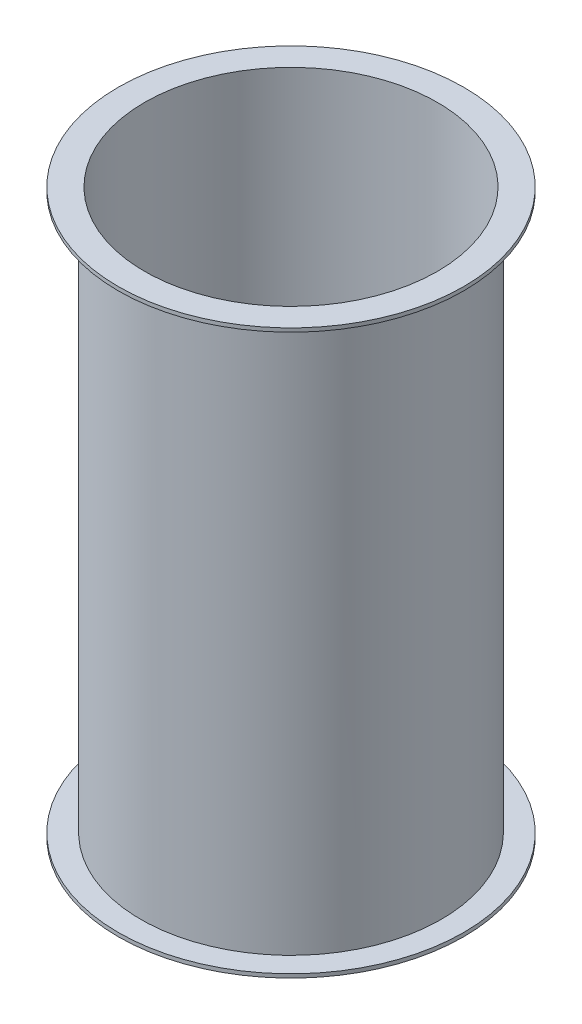
from build123d import *

# Parameters (mm, degrees)
SCHIZZO1_R                   = 40
SCHIZZO1_R_2                 = 39
ESTRUSIONE_SOTTILE1_DEPTH    = 150
ESTRUSIONE_ESTRUSIONE1_START = -1
SCHIZZO2_R                   = 46
SCHIZZO2_R_2                 = 40
ESTRUSIONE_ESTRUSIONE1_DEPTH = 1
SCHIZZO3_R                   = 46
SCHIZZO3_R_2                 = 40
ESTRUSIONE_ESTRUSIONE2_DEPTH = 1


with BuildPart() as part:
    # Schizzo1 → Estrusione-Sottile1 (new body)
    with BuildSketch(Plane(origin=(0, 0, 0), x_dir=(1, 0, 0), z_dir=(0, 1, 0))):
        Circle(SCHIZZO1_R)
        Circle(SCHIZZO1_R_2, mode=Mode.SUBTRACT)
    extrude(amount=ESTRUSIONE_SOTTILE1_DEPTH)

    # Schizzo2 → Estrusione-Estrusione1 (add)
    with BuildSketch(Plane(origin=(0, 150, 0), x_dir=(1, 0, 0), z_dir=(0, 1, 0)).offset(ESTRUSIONE_ESTRUSIONE1_START)):
        with Locations(Location((0, 0, 0), (0, 0, 270))):
            Circle(SCHIZZO2_R)
        with Locations(Location((0, 0, 0), (0, 0, 270))):
            Circle(SCHIZZO2_R_2, mode=Mode.SUBTRACT)
    extrude(amount=ESTRUSIONE_ESTRUSIONE1_DEPTH)

    # Schizzo3 → Estrusione-Estrusione2 (add)
    with BuildSketch(Plane.XZ):
        with Locations(Location((0, 0, 0), (0, 0, 90))):
            Circle(SCHIZZO3_R)
        with Locations(Location((0, 0, 0), (0, 0, 270))):
            Circle(SCHIZZO3_R_2, mode=Mode.SUBTRACT)
    extrude(amount=-ESTRUSIONE_ESTRUSIONE2_DEPTH)


solid = part.part
